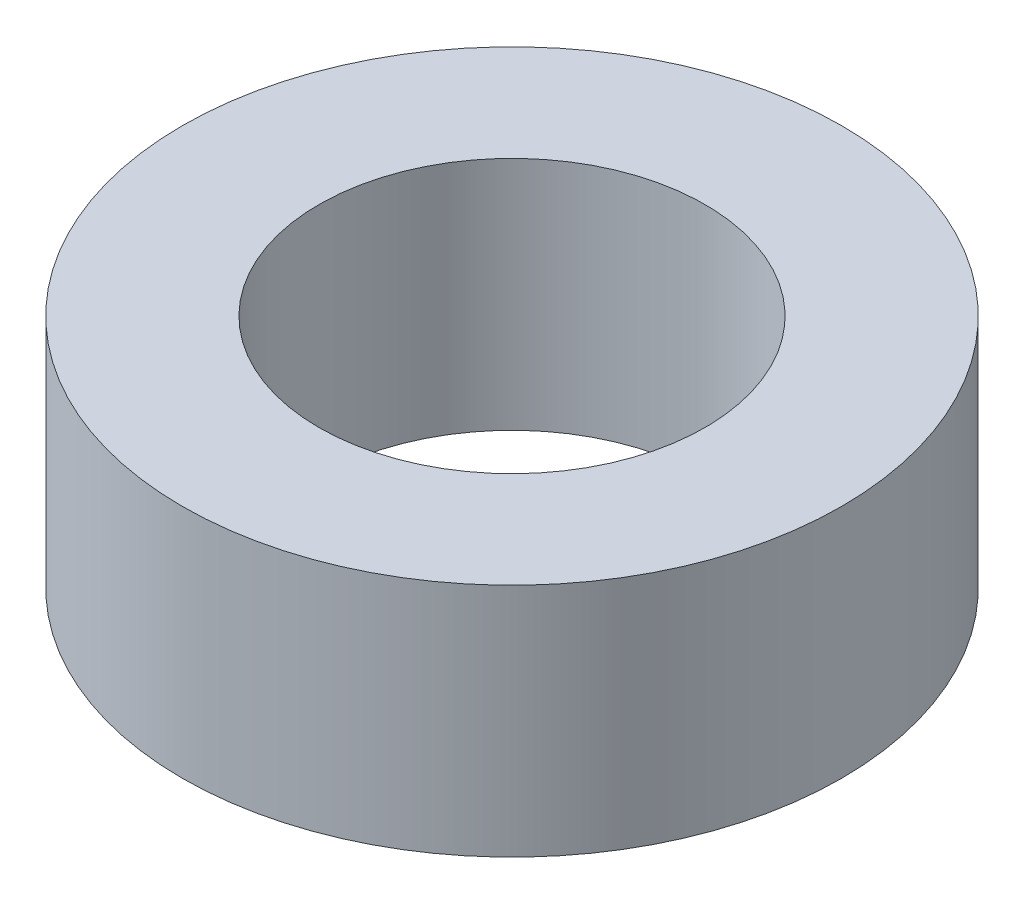
from build123d import *

# Parameters (mm, degrees)
SKETCH_1_R      = 7
SKETCH_1_R_2    = 4.1
EXTRUDE_1_DEPTH = 5


with BuildPart() as part:
    # 草图1 → 凸台-拉伸1 (new body)
    with BuildSketch(Plane(origin=(0, 0, 0), x_dir=(1, 0, 0), z_dir=(0, 1, 0))):
        with Locations(Location((0, 0, 0), (0, 0, 270))):
            Circle(SKETCH_1_R)
        with Locations(Location((0, 0, 0), (0, 0, 270))):
            Circle(SKETCH_1_R_2, mode=Mode.SUBTRACT)
    extrude(amount=EXTRUDE_1_DEPTH)


solid = part.part
